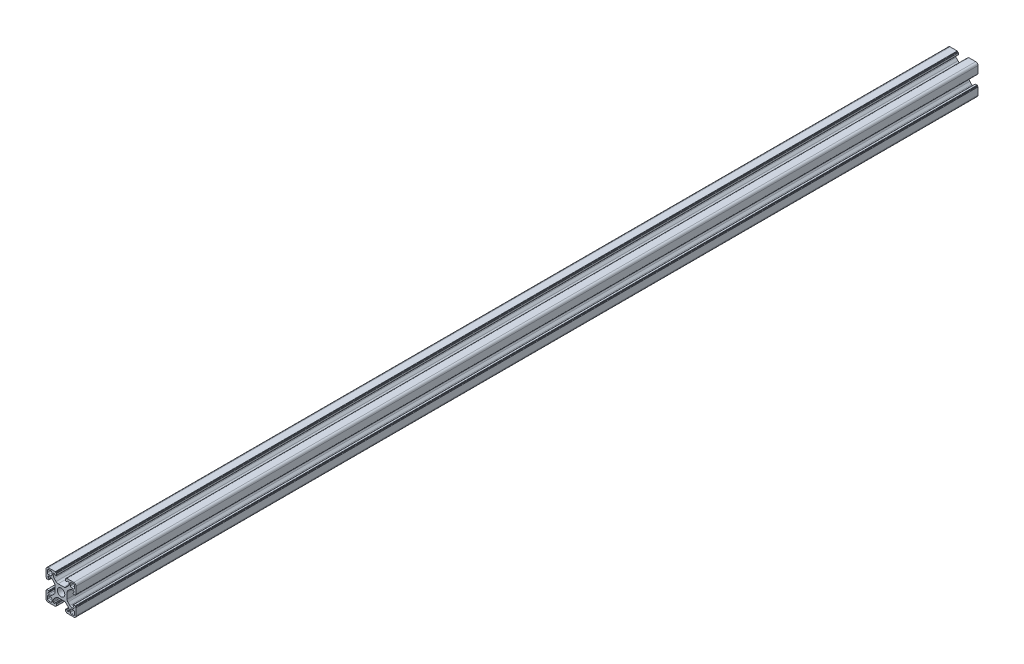
from build123d import *

# Parameters (mm, degrees)
EXTRUDE_1_DEPTH = 600


with BuildPart() as part:
    # Эскиз1 → Бобышка-Вытянуть1 (new body)
    with BuildSketch(Plane.XY):
        with BuildLine():
            Line((-31.105150957, 65.209647948), (-29.206370287, 65.209647948))
            ThreePointArc((-29.206370287, 65.209647948), (-28.441003423, 65.361888883), (-27.792156725, 65.795434385))
            Line((-27.792156725, 65.795434385), (-26.490937394, 67.096653716))
            ThreePointArc((-26.490937394, 67.096653716), (-26.057391892, 67.745500414), (-25.905150957, 68.510867279))
            Line((-25.905150957, 68.510867279), (-25.905150957, 69.409647948))
            ThreePointArc((-25.905150957, 69.409647948), (-26.051597566, 69.763201338), (-26.405150957, 69.909647948))
            Line((-26.405150957, 69.909647948), (-26.508044175, 69.909647948))
            ThreePointArc((-26.508044175, 69.909647948), (-26.699385892, 69.871587714), (-26.861597566, 69.763201338))
            Line((-26.861597566, 69.763201338), (-27.341927652, 69.282871252))
            ThreePointArc((-27.341927652, 69.282871252), (-27.423033489, 69.228678065), (-27.518704347, 69.209647948))
            Line((-27.518704347, 69.209647948), (-27.805150957, 69.209647948))
            ThreePointArc((-27.805150957, 69.209647948), (-27.981927652, 69.282871252), (-28.055150957, 69.459647948))
            Line((-28.055150957, 69.459647948), (-28.055150957, 70.608718768))
            ThreePointArc((-28.055150957, 70.608718768), (-28.011216974, 70.714784785), (-27.905150957, 70.758718768))
            Line((-27.905150957, 70.758718768), (-27.405150957, 70.758718768))
            Line((-27.405150957, 70.758718768), (-27.405150957, 71.059647948))
            ThreePointArc((-27.405150957, 71.059647948), (-27.361216974, 71.165713965), (-27.255150957, 71.209647948))
            Line((-27.255150957, 71.209647948), (-22.605150957, 71.209647948))
            ThreePointArc((-22.605150957, 71.209647948), (-21.544490785, 70.770308119), (-21.105150957, 69.709647948))
            Line((-21.105150957, 69.709647948), (-21.105150957, 65.059647948))
            ThreePointArc((-21.105150957, 65.059647948), (-21.149084939, 64.953581931), (-21.255150957, 64.909647948))
            Line((-21.255150957, 64.909647948), (-21.556080136, 64.909647948))
            Line((-21.556080136, 64.909647948), (-21.556080136, 64.409647948))
            ThreePointArc((-21.556080136, 64.409647948), (-21.600014119, 64.303581931), (-21.706080136, 64.259647948))
            Line((-21.706080136, 64.259647948), (-22.855150957, 64.259647948))
            ThreePointArc((-22.855150957, 64.259647948), (-23.031927652, 64.332871252), (-23.105150957, 64.509647948))
            Line((-23.105150957, 64.509647948), (-23.105150957, 64.796094557))
            ThreePointArc((-23.105150957, 64.796094557), (-23.08612084, 64.891765415), (-23.031927652, 64.972871252))
            Line((-23.031927652, 64.972871252), (-22.551597566, 65.453201338))
            ThreePointArc((-22.551597566, 65.453201338), (-22.44321119, 65.615413013), (-22.405150957, 65.806754729))
            Line((-22.405150957, 65.806754729), (-22.405150957, 65.909647948))
            ThreePointArc((-22.405150957, 65.909647948), (-22.551597566, 66.263201338), (-22.905150957, 66.409647948))
            Line((-22.905150957, 66.409647948), (-23.803931626, 66.409647948))
            ThreePointArc((-23.803931626, 66.409647948), (-24.56929849, 66.257407013), (-25.218145188, 65.82386151))
            Line((-25.218145188, 65.82386151), (-26.519364519, 64.522642179))
            ThreePointArc((-26.519364519, 64.522642179), (-26.952910022, 63.873795482), (-27.105150957, 63.108428617))
            Line((-27.105150957, 63.108428617), (-27.105150957, 61.209647948))
            Line((-27.105150957, 61.209647948), (-27.105150957, 59.310867279))
            ThreePointArc((-27.105150957, 59.310867279), (-26.952910022, 58.545500414), (-26.519364519, 57.896653716))
            Line((-26.519364519, 57.896653716), (-25.218145188, 56.595434385))
            ThreePointArc((-25.218145188, 56.595434385), (-24.56929849, 56.161888883), (-23.803931626, 56.009647948))
            Line((-23.803931626, 56.009647948), (-22.905150957, 56.009647948))
            ThreePointArc((-22.905150957, 56.009647948), (-22.551597566, 56.156094557), (-22.405150957, 56.509647948))
            Line((-22.405150957, 56.509647948), (-22.405150957, 56.612541166))
            ThreePointArc((-22.405150957, 56.612541166), (-22.44321119, 56.803882883), (-22.551597566, 56.966094557))
            Line((-22.551597566, 56.966094557), (-23.031927652, 57.446424643))
            ThreePointArc((-23.031927652, 57.446424643), (-23.08612084, 57.52753048), (-23.105150957, 57.623201338))
            Line((-23.105150957, 57.623201338), (-23.105150957, 57.909647948))
            ThreePointArc((-23.105150957, 57.909647948), (-23.031927652, 58.086424643), (-22.855150957, 58.159647948))
            Line((-22.855150957, 58.159647948), (-21.706080136, 58.159647948))
            ThreePointArc((-21.706080136, 58.159647948), (-21.600014119, 58.115713965), (-21.556080136, 58.009647948))
            Line((-21.556080136, 58.009647948), (-21.556080136, 57.509647948))
            Line((-21.556080136, 57.509647948), (-21.255150957, 57.509647948))
            ThreePointArc((-21.255150957, 57.509647948), (-21.149084939, 57.465713965), (-21.105150957, 57.359647948))
            Line((-21.105150957, 57.359647948), (-21.105150957, 52.709647948))
            ThreePointArc((-21.105150957, 52.709647948), (-21.544490785, 51.648987776), (-22.605150957, 51.209647948))
            Line((-22.605150957, 51.209647948), (-27.255150957, 51.209647948))
            ThreePointArc((-27.255150957, 51.209647948), (-27.361216974, 51.253581931), (-27.405150957, 51.359647948))
            Line((-27.405150957, 51.359647948), (-27.405150957, 51.660577127))
            Line((-27.405150957, 51.660577127), (-27.905150957, 51.660577127))
            ThreePointArc((-27.905150957, 51.660577127), (-28.011216974, 51.70451111), (-28.055150957, 51.810577127))
            Line((-28.055150957, 51.810577127), (-28.055150957, 52.959647948))
            ThreePointArc((-28.055150957, 52.959647948), (-27.981927652, 53.136424643), (-27.805150957, 53.209647948))
            Line((-27.805150957, 53.209647948), (-27.518704347, 53.209647948))
            ThreePointArc((-27.518704347, 53.209647948), (-27.423033489, 53.190617831), (-27.341927652, 53.136424643))
            Line((-27.341927652, 53.136424643), (-26.861597566, 52.656094557))
            ThreePointArc((-26.861597566, 52.656094557), (-26.699385892, 52.547708181), (-26.508044175, 52.509647948))
            Line((-26.508044175, 52.509647948), (-26.405150957, 52.509647948))
            ThreePointArc((-26.405150957, 52.509647948), (-26.051597566, 52.656094557), (-25.905150957, 53.009647948))
            Line((-25.905150957, 53.009647948), (-25.905150957, 53.908428617))
            ThreePointArc((-25.905150957, 53.908428617), (-26.057391892, 54.673795482), (-26.490937394, 55.322642179))
            Line((-26.490937394, 55.322642179), (-27.792156725, 56.62386151))
            ThreePointArc((-27.792156725, 56.62386151), (-28.441003423, 57.057407013), (-29.206370287, 57.209647948))
            Line((-29.206370287, 57.209647948), (-31.105150957, 57.209647948))
            Line((-31.105150957, 57.209647948), (-33.003931626, 57.209647948))
            ThreePointArc((-33.003931626, 57.209647948), (-33.76929849, 57.057407013), (-34.418145188, 56.62386151))
            Line((-34.418145188, 56.62386151), (-35.719364519, 55.322642179))
            ThreePointArc((-35.719364519, 55.322642179), (-36.152910022, 54.673795482), (-36.305150957, 53.908428617))
            Line((-36.305150957, 53.908428617), (-36.305150957, 53.009647948))
            ThreePointArc((-36.305150957, 53.009647948), (-36.158704347, 52.656094557), (-35.805150957, 52.509647948))
            Line((-35.805150957, 52.509647948), (-35.702257738, 52.509647948))
            ThreePointArc((-35.702257738, 52.509647948), (-35.510916022, 52.547708181), (-35.348704347, 52.656094557))
            Line((-35.348704347, 52.656094557), (-34.868374261, 53.136424643))
            ThreePointArc((-34.868374261, 53.136424643), (-34.787268424, 53.190617831), (-34.691597566, 53.209647948))
            Line((-34.691597566, 53.209647948), (-34.405150957, 53.209647948))
            ThreePointArc((-34.405150957, 53.209647948), (-34.228374261, 53.136424643), (-34.155150957, 52.959647948))
            Line((-34.155150957, 52.959647948), (-34.155150957, 51.810577127))
            ThreePointArc((-34.155150957, 51.810577127), (-34.199084939, 51.70451111), (-34.305150957, 51.660577127))
            Line((-34.305150957, 51.660577127), (-34.805150957, 51.660577127))
            Line((-34.805150957, 51.660577127), (-34.805150957, 51.359647948))
            ThreePointArc((-34.805150957, 51.359647948), (-34.849084939, 51.253581931), (-34.955150957, 51.209647948))
            Line((-34.955150957, 51.209647948), (-39.605150957, 51.209647948))
            ThreePointArc((-39.605150957, 51.209647948), (-40.665811128, 51.648987776), (-41.105150957, 52.709647948))
            Line((-41.105150957, 52.709647948), (-41.105150957, 57.359647948))
            ThreePointArc((-41.105150957, 57.359647948), (-41.061216974, 57.465713965), (-40.955150957, 57.509647948))
            Line((-40.955150957, 57.509647948), (-40.654221777, 57.509647948))
            Line((-40.654221777, 57.509647948), (-40.654221777, 58.009647948))
            ThreePointArc((-40.654221777, 58.009647948), (-40.610287794, 58.115713965), (-40.504221777, 58.159647948))
            Line((-40.504221777, 58.159647948), (-39.355150957, 58.159647948))
            ThreePointArc((-39.355150957, 58.159647948), (-39.178374261, 58.086424643), (-39.105150957, 57.909647948))
            Line((-39.105150957, 57.909647948), (-39.105150957, 57.623201338))
            ThreePointArc((-39.105150957, 57.623201338), (-39.124181073, 57.52753048), (-39.178374261, 57.446424643))
            Line((-39.178374261, 57.446424643), (-39.658704347, 56.966094557))
            ThreePointArc((-39.658704347, 56.966094557), (-39.767090723, 56.803882883), (-39.805150957, 56.612541166))
            Line((-39.805150957, 56.612541166), (-39.805150957, 56.509647948))
            ThreePointArc((-39.805150957, 56.509647948), (-39.658704347, 56.156094557), (-39.305150957, 56.009647948))
            Line((-39.305150957, 56.009647948), (-38.406370287, 56.009647948))
            ThreePointArc((-38.406370287, 56.009647948), (-37.641003423, 56.161888883), (-36.992156725, 56.595434385))
            Line((-36.992156725, 56.595434385), (-35.690937394, 57.896653716))
            ThreePointArc((-35.690937394, 57.896653716), (-35.257391892, 58.545500414), (-35.105150957, 59.310867279))
            Line((-35.105150957, 59.310867279), (-35.105150957, 61.209647948))
            Line((-35.105150957, 61.209647948), (-35.105150957, 63.108428617))
            ThreePointArc((-35.105150957, 63.108428617), (-35.257391892, 63.873795482), (-35.690937394, 64.522642179))
            Line((-35.690937394, 64.522642179), (-36.992156725, 65.82386151))
            ThreePointArc((-36.992156725, 65.82386151), (-37.641003423, 66.257407013), (-38.406370287, 66.409647948))
            Line((-38.406370287, 66.409647948), (-39.305150957, 66.409647948))
            ThreePointArc((-39.305150957, 66.409647948), (-39.658704347, 66.263201338), (-39.805150957, 65.909647948))
            Line((-39.805150957, 65.909647948), (-39.805150957, 65.806754729))
            ThreePointArc((-39.805150957, 65.806754729), (-39.767090723, 65.615413013), (-39.658704347, 65.453201338))
            Line((-39.658704347, 65.453201338), (-39.178374261, 64.972871252))
            ThreePointArc((-39.178374261, 64.972871252), (-39.124181073, 64.891765415), (-39.105150957, 64.796094557))
            Line((-39.105150957, 64.796094557), (-39.105150957, 64.509647948))
            ThreePointArc((-39.105150957, 64.509647948), (-39.178374261, 64.332871252), (-39.355150957, 64.259647948))
            Line((-39.355150957, 64.259647948), (-40.504221777, 64.259647948))
            ThreePointArc((-40.504221777, 64.259647948), (-40.610287794, 64.303581931), (-40.654221777, 64.409647948))
            Line((-40.654221777, 64.409647948), (-40.654221777, 64.909647948))
            Line((-40.654221777, 64.909647948), (-40.955150957, 64.909647948))
            ThreePointArc((-40.955150957, 64.909647948), (-41.061216974, 64.953581931), (-41.105150957, 65.059647948))
            Line((-41.105150957, 65.059647948), (-41.105150957, 69.709647948))
            ThreePointArc((-41.105150957, 69.709647948), (-40.665811128, 70.770308119), (-39.605150957, 71.209647948))
            Line((-39.605150957, 71.209647948), (-34.955150957, 71.209647948))
            ThreePointArc((-34.955150957, 71.209647948), (-34.849084939, 71.165713965), (-34.805150957, 71.059647948))
            Line((-34.805150957, 71.059647948), (-34.805150957, 70.758718768))
            Line((-34.805150957, 70.758718768), (-34.305150957, 70.758718768))
            ThreePointArc((-34.305150957, 70.758718768), (-34.199084939, 70.714784785), (-34.155150957, 70.608718768))
            Line((-34.155150957, 70.608718768), (-34.155150957, 69.459647948))
            ThreePointArc((-34.155150957, 69.459647948), (-34.228374261, 69.282871252), (-34.405150957, 69.209647948))
            Line((-34.405150957, 69.209647948), (-34.691597566, 69.209647948))
            ThreePointArc((-34.691597566, 69.209647948), (-34.787268424, 69.228678065), (-34.868374261, 69.282871252))
            Line((-34.868374261, 69.282871252), (-35.348704347, 69.763201338))
            ThreePointArc((-35.348704347, 69.763201338), (-35.510916022, 69.871587714), (-35.702257738, 69.909647948))
            Line((-35.702257738, 69.909647948), (-35.805150957, 69.909647948))
            ThreePointArc((-35.805150957, 69.909647948), (-36.158704347, 69.763201338), (-36.305150957, 69.409647948))
            Line((-36.305150957, 69.409647948), (-36.305150957, 68.510867279))
            ThreePointArc((-36.305150957, 68.510867279), (-36.152910022, 67.745500414), (-35.719364519, 67.096653716))
            Line((-35.719364519, 67.096653716), (-34.418145188, 65.795434385))
            ThreePointArc((-34.418145188, 65.795434385), (-33.76929849, 65.361888883), (-33.003931626, 65.209647948))
            Line((-33.003931626, 65.209647948), (-31.105150957, 65.209647948))
        make_face()
        with BuildLine():
            Line((-24.205150957, 67.309647948), (-22.805150957, 67.309647948))
            ThreePointArc((-22.805150957, 67.309647948), (-22.239465532, 67.543962523), (-22.005150957, 68.109647948))
            Line((-22.005150957, 68.109647948), (-22.005150957, 69.509647948))
            ThreePointArc((-22.005150957, 69.509647948), (-22.239465532, 70.075333373), (-22.805150957, 70.309647948))
            Line((-22.805150957, 70.309647948), (-24.205150957, 70.309647948))
            ThreePointArc((-24.205150957, 70.309647948), (-24.770836381, 70.075333373), (-25.005150957, 69.509647948))
            Line((-25.005150957, 69.509647948), (-25.005150957, 68.109647948))
            ThreePointArc((-25.005150957, 68.109647948), (-24.770836381, 67.543962523), (-24.205150957, 67.309647948))
        make_face(mode=Mode.SUBTRACT)
        with BuildLine():
            Line((-25.005150957, 54.309647948), (-25.005150957, 52.909647948))
            ThreePointArc((-25.005150957, 52.909647948), (-24.770836381, 52.343962523), (-24.205150957, 52.109647948))
            Line((-24.205150957, 52.109647948), (-22.805150957, 52.109647948))
            ThreePointArc((-22.805150957, 52.109647948), (-22.239465532, 52.343962523), (-22.005150957, 52.909647948))
            Line((-22.005150957, 52.909647948), (-22.005150957, 54.309647948))
            ThreePointArc((-22.005150957, 54.309647948), (-22.239465532, 54.875333373), (-22.805150957, 55.109647948))
            Line((-22.805150957, 55.109647948), (-24.205150957, 55.109647948))
            ThreePointArc((-24.205150957, 55.109647948), (-24.770836381, 54.875333373), (-25.005150957, 54.309647948))
        make_face(mode=Mode.SUBTRACT)
        with BuildLine():
            Line((-38.005150957, 55.109647948), (-39.405150957, 55.109647948))
            ThreePointArc((-39.405150957, 55.109647948), (-39.970836381, 54.875333373), (-40.205150957, 54.309647948))
            Line((-40.205150957, 54.309647948), (-40.205150957, 52.909647948))
            ThreePointArc((-40.205150957, 52.909647948), (-39.970836381, 52.343962523), (-39.405150957, 52.109647948))
            Line((-39.405150957, 52.109647948), (-38.005150957, 52.109647948))
            ThreePointArc((-38.005150957, 52.109647948), (-37.439465532, 52.343962523), (-37.205150957, 52.909647948))
            Line((-37.205150957, 52.909647948), (-37.205150957, 54.309647948))
            ThreePointArc((-37.205150957, 54.309647948), (-37.439465532, 54.875333373), (-38.005150957, 55.109647948))
        make_face(mode=Mode.SUBTRACT)
        with BuildLine():
            Line((-37.205150957, 68.109647948), (-37.205150957, 69.509647948))
            ThreePointArc((-37.205150957, 69.509647948), (-37.439465532, 70.075333373), (-38.005150957, 70.309647948))
            Line((-38.005150957, 70.309647948), (-39.405150957, 70.309647948))
            ThreePointArc((-39.405150957, 70.309647948), (-39.970836381, 70.075333373), (-40.205150957, 69.509647948))
            Line((-40.205150957, 69.509647948), (-40.205150957, 68.109647948))
            ThreePointArc((-40.205150957, 68.109647948), (-39.970836381, 67.543962523), (-39.405150957, 67.309647948))
            Line((-39.405150957, 67.309647948), (-38.005150957, 67.309647948))
            ThreePointArc((-38.005150957, 67.309647948), (-37.439465532, 67.543962523), (-37.205150957, 68.109647948))
        make_face(mode=Mode.SUBTRACT)
        with BuildLine():
            ThreePointArc((-28.605150957, 61.209647948), (-29.337384004, 62.977414901), (-31.105150957, 63.709647948))
            ThreePointArc((-31.105150957, 63.709647948), (-32.87291791, 62.977414901), (-33.605150957, 61.209647948))
            ThreePointArc((-33.605150957, 61.209647948), (-32.87291791, 59.441880995), (-31.105150957, 58.709647948))
            ThreePointArc((-31.105150957, 58.709647948), (-29.337384004, 59.441880995), (-28.605150957, 61.209647948))
        make_face(mode=Mode.SUBTRACT)
    extrude(amount=EXTRUDE_1_DEPTH)


solid = part.part
